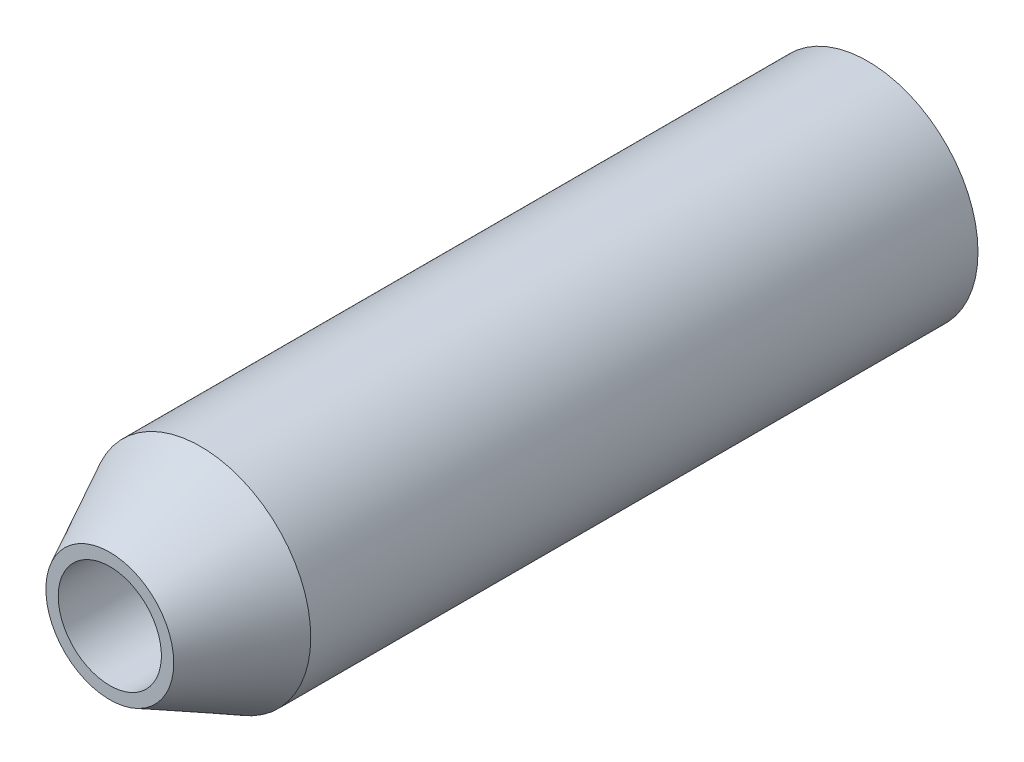
from build123d import *

# Parameters (mm, degrees)
CROQUIS3_R                                           = 3.175
SALIENTE_EXTRUIR2_DEPTH                              = 10.922
REFRENTADO_PARA_TORNILLO_CON_CABEZA_HUEC_D           = 2.9718
REFRENTADO_PARA_TORNILLO_CON_CABEZA_HUEC_CBORE_D     = 4.699
REFRENTADO_PARA_TORNILLO_CON_CABEZA_HUEC_CBORE_DEPTH = 16.637


with BuildPart() as part:
    # Croquis3 → Saliente-Extruir2 (new, symmetric)
    with BuildSketch(Plane.XY):
        Circle(CROQUIS3_R)
    extrude(amount=SALIENTE_EXTRUIR2_DEPTH, both=True)

    # Refrentado para tornillo con cabeza hueca de 1/41 (through all)
    with Locations(Plane(origin=(0, 0, -10.922), x_dir=(-1, 0, 0), z_dir=(0, 0, -1))):
        with Locations((0, 0)):
            CounterBoreHole(REFRENTADO_PARA_TORNILLO_CON_CABEZA_HUEC_D / 2, REFRENTADO_PARA_TORNILLO_CON_CABEZA_HUEC_CBORE_D / 2, REFRENTADO_PARA_TORNILLO_CON_CABEZA_HUEC_CBORE_DEPTH)

    # Croquis7 → Cortar-Revolución1 (revolve, cut)
    with BuildSketch(Plane(origin=(0, 0, 0), x_dir=(1, 0, 0), z_dir=(0, 1, 0)), mode=Mode.PRIVATE) as cortar_revoluci_n1_sk:
        Polygon((-3.175, -8.3058), (-1.841979519, -10.922), (-3.175, -10.922), align=None)
    revolve(cortar_revoluci_n1_sk.sketch.rotate(Axis((0, 0, 10.922), (0, 0, -1)), 180), axis=Axis((0, 0, 10.922), (0, 0, -1)), mode=Mode.SUBTRACT)


solid = part.part
